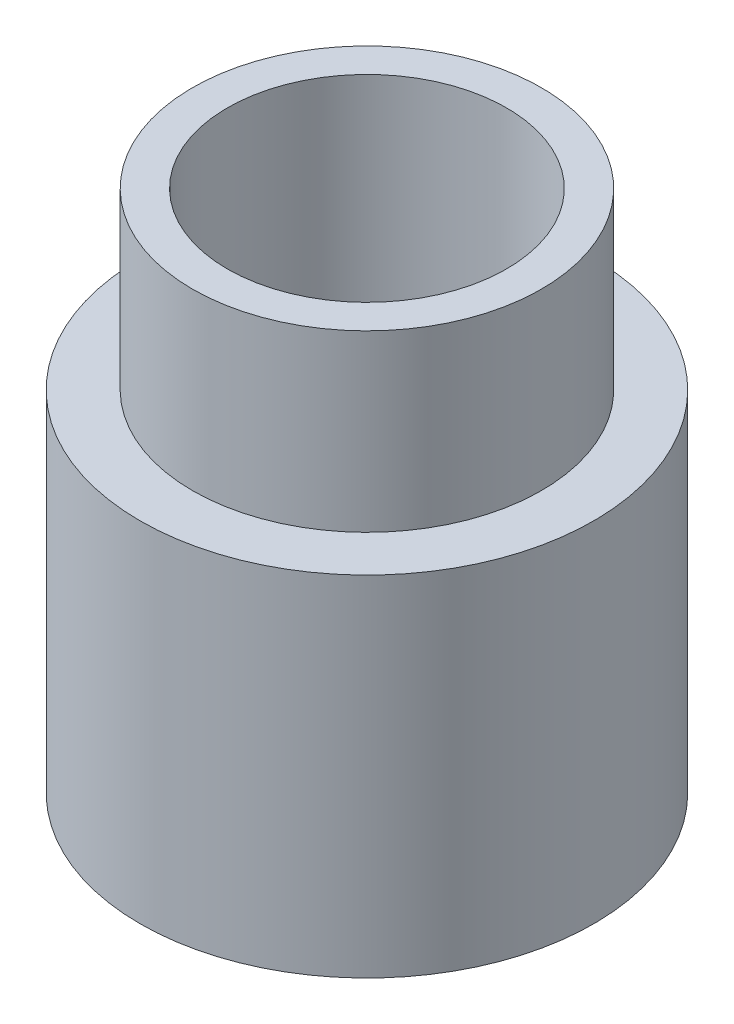
from build123d import *

# Parameters (mm, degrees)
SKETCH1_R           = 6.5
BOSS_EXTRUDE1_DEPTH = 10
SKETCH2_R           = 5
BOSS_EXTRUDE2_DEPTH = 5
SHELL1_T            = -1


with BuildPart() as part:
    # Sketch1 → Boss-Extrude1 (new body)
    with BuildSketch(Plane(origin=(0, 0, 0), x_dir=(1, 0, 0), z_dir=(0, 1, 0))):
        with Locations(Location((0, 0, 0), (0, 0, 270))):
            Circle(SKETCH1_R)
    extrude(amount=BOSS_EXTRUDE1_DEPTH)

    # Sketch2 → Boss-Extrude2 (add)
    with BuildSketch(Plane(origin=(0, 10, 0), x_dir=(1, 0, 0), z_dir=(0, 1, 0))):
        with Locations(Location((0, 0, 0), (0, 0, 270))):
            Circle(SKETCH2_R)
    extrude(amount=BOSS_EXTRUDE2_DEPTH)

    # Shell1
    shell1_openings = [part.faces().sort_by_distance(p)[0] for p in [
        (0, 15, 0),
    ]]
    offset(amount=SHELL1_T, openings=shell1_openings, kind=Kind.INTERSECTION)


solid = part.part
